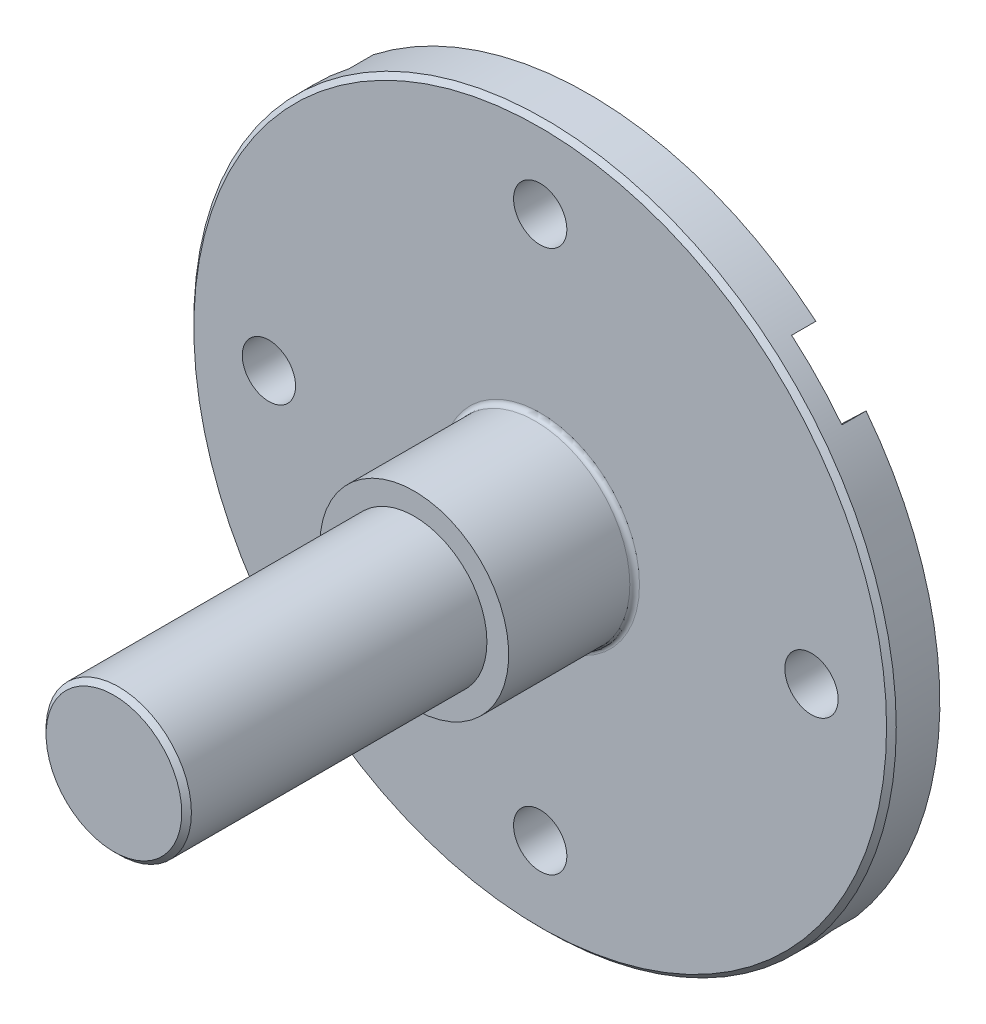
from build123d import *

# Parameters (mm, degrees)
SCHIZZO1_R                  = 72.5
ESTRUSIONE1_DEPTH           = 10
SCHIZZO2_R                  = 19.5
ESTRUSIONE2_DEPTH           = 26
ESTRUSIONE5_DEPTH           = 62
ESTRUSIONE5_DEPTH_BACK      = 5
SCHIZZO5_R                  = 15
SMUSSO2_SIZE                = 1
RACCORDO1_R                 = 1
ESTRUSIONE3_DEPTH           = 5
RIPETIZIONECIRCOLARE1_COUNT = 4
SMUSSO3_SIZE                = 1
M10_GIOCHI_FORO1_D          = 11


with BuildPart() as part:
    # Schizzo1 → Estrusione1 (new body)
    with BuildSketch(Plane.XY):
        Circle(SCHIZZO1_R)
    extrude(amount=ESTRUSIONE1_DEPTH)

    # Schizzo2 → Estrusione2 (add)
    with BuildSketch(Plane.XY.offset(10)):
        with Locations(Location((0, 0, 0), (0, 0, 180))):
            Circle(SCHIZZO2_R)
    extrude(amount=ESTRUSIONE2_DEPTH)

    # Schizzo5 → Estrusione5 (add, two sides: drawn at the far end of the back side and taken through both)
    with BuildSketch(Plane.XY.offset(36).offset(-ESTRUSIONE5_DEPTH_BACK)):
        Circle(SCHIZZO5_R)
    extrude(amount=ESTRUSIONE5_DEPTH + ESTRUSIONE5_DEPTH_BACK)

    # Smusso2
    smusso2_edges = [part.edges().sort_by_distance(p)[0] for p in [
        (-72.5, 0, 10),
    ]]
    chamfer(smusso2_edges, length=SMUSSO2_SIZE)

    # Raccordo1
    raccordo1_edges = [part.edges().sort_by_distance(p)[0] for p in [
        (19.5, 0, 10),
    ]]
    fillet(raccordo1_edges, radius=RACCORDO1_R)

    # Schizzo3 → Estrusione3 (cut)
    with BuildSketch(Plane(origin=(0, 0, 0), x_dir=(-1, 0, 0), z_dir=(0, 0, -1))):
        with BuildLine():
            Line((-57.271310306, 44.454999897), (-23.243993136, 11.87294332))
            ThreePointArc((-23.243993136, 11.87294332), (-12.639887246, 12.103026498), (-12.869970423, 22.707132388))
            Line((-12.869970423, 22.707132388), (-46.897287593, 55.289188965))
            ThreePointArc((-46.897287593, 55.289188965), (-52.365247161, 50.141109778), (-57.271310306, 44.454999897))
        make_face()
    estrusione3 = extrude(amount=-ESTRUSIONE3_DEPTH, mode=Mode.SUBTRACT)

    # RipetizioneCircolare1: Estrusione3 ×4 about axis
    ripetizionecircolare1_axis = Axis((0, 0, 0), (0, 0, 1))
    for i in range(1, RIPETIZIONECIRCOLARE1_COUNT):
        add(estrusione3.rotate(ripetizionecircolare1_axis, i * 360 / RIPETIZIONECIRCOLARE1_COUNT), mode=Mode.SUBTRACT)

    # Smusso3
    smusso3_edges = [part.edges().sort_by_distance(p)[0] for p in [
        (-15, 0, 98),
    ]]
    chamfer(smusso3_edges, length=SMUSSO3_SIZE)

    # M10 Giochi foro1 (through all)
    with Locations(Plane(origin=(8.775277543, -26.129129274, 10), x_dir=(0.9999999999861032, 5.271953212239764e-06, 0), z_dir=(0, 0, 1))):
        with Locations((-8.776166907, 82.129175527), (-8.776166907, -29.870824473), (-64.776166907, 26.129175527), (47.223833093, 26.129175527)):
            Hole(M10_GIOCHI_FORO1_D / 2)


solid = part.part
